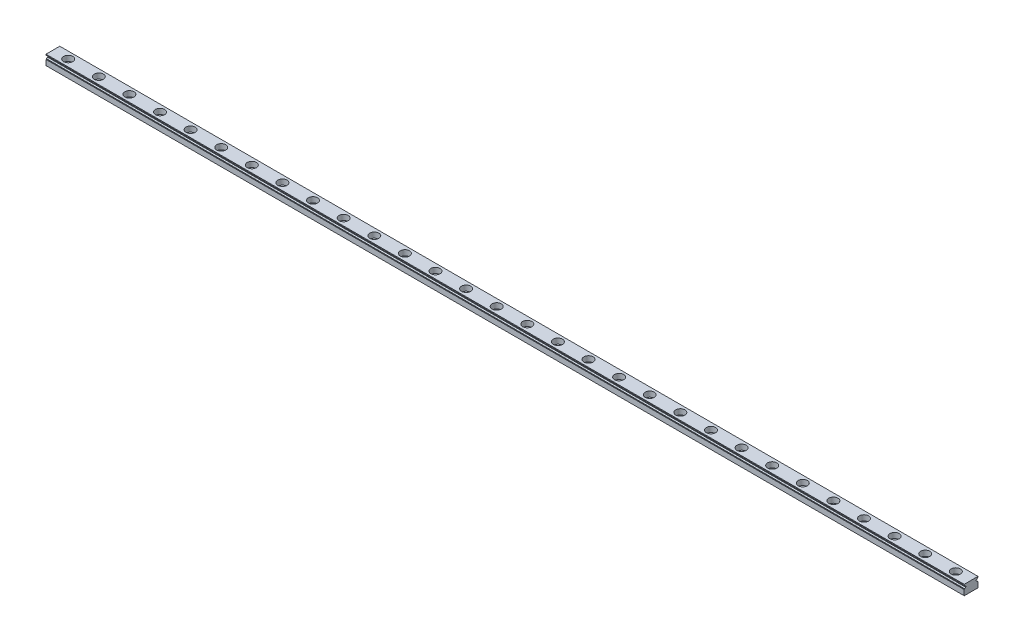
from build123d import *

# Parameters (mm, degrees)
BOSS_EXTRU_1_DEPTH                                 = 600
ESQUISSE2_W                                        = 0.3
ESQUISSE2_H                                        = 2.4
ENL_V_MAT_EXTRU_1_DEPTH                            = 601.052081073
CHAMBRAGE_POUR_VIS_T_TE_HEXAGONALE_M31_D           = 3.5
CHAMBRAGE_POUR_VIS_T_TE_HEXAGONALE_M31_CBORE_D     = 6
CHAMBRAGE_POUR_VIS_T_TE_HEXAGONALE_M31_CBORE_DEPTH = 3.5
R_P_TITION_LIN_AIRE1_COUNT                         = 30
R_P_TITION_LIN_AIRE1_PITCH                         = 20


with BuildPart() as part:
    # Esquisse1 → Boss.-Extru.1 (new body)
    with BuildSketch(Plane(origin=(0, 0, 0), x_dir=(0, 0, -1), z_dir=(1, 0, 0))):
        Polygon((-4.5, 0), (4.5, 0), (4.5, 3.5), (3.6, 4.4), (3.3, 4.4), (3.3, 5), (3.6, 5), (4.5, 5.9), (4.5, 6.5), (-4.5, 6.5), (-4.5, 5.9), (-3.6, 5), (-3.3, 5), (-3.3, 4.4), (-3.6, 4.4), (-4.5, 3.5), align=None)
    extrude(amount=BOSS_EXTRU_1_DEPTH)

    # Esquisse2 → Enlèv. mat.-Extru.1 (cut, through all)
    with BuildSketch(Plane(origin=(0, 0, 0), x_dir=(0, 0, -1), z_dir=(1, 0, 0))):
        with Locations((4.35, 4.7)):
            Rectangle(ESQUISSE2_W, ESQUISSE2_H)
        with Locations((-4.35, 4.7)):
            Rectangle(ESQUISSE2_W, ESQUISSE2_H)
    extrude(amount=ENL_V_MAT_EXTRU_1_DEPTH, mode=Mode.SUBTRACT)

    # Chambrage pour vis à tête hexagonale M31 (through all)
    with Locations(Plane(origin=(0, 6.5, 0), x_dir=(1, 0, 0), z_dir=(0, 1, 0))):
        with Locations((10, 0)):
            chambrage_pour_vis_t_te_hexagonale_m31 = CounterBoreHole(CHAMBRAGE_POUR_VIS_T_TE_HEXAGONALE_M31_D / 2, CHAMBRAGE_POUR_VIS_T_TE_HEXAGONALE_M31_CBORE_D / 2, CHAMBRAGE_POUR_VIS_T_TE_HEXAGONALE_M31_CBORE_DEPTH)

    # Répétition linéaire1: Chambrage pour vis à tête hexagonale M31 ×30
    with Locations(*[(i * R_P_TITION_LIN_AIRE1_PITCH, 0, 0) for i in range(1, R_P_TITION_LIN_AIRE1_COUNT)]):
        add(chambrage_pour_vis_t_te_hexagonale_m31, mode=Mode.SUBTRACT)


solid = part.part
